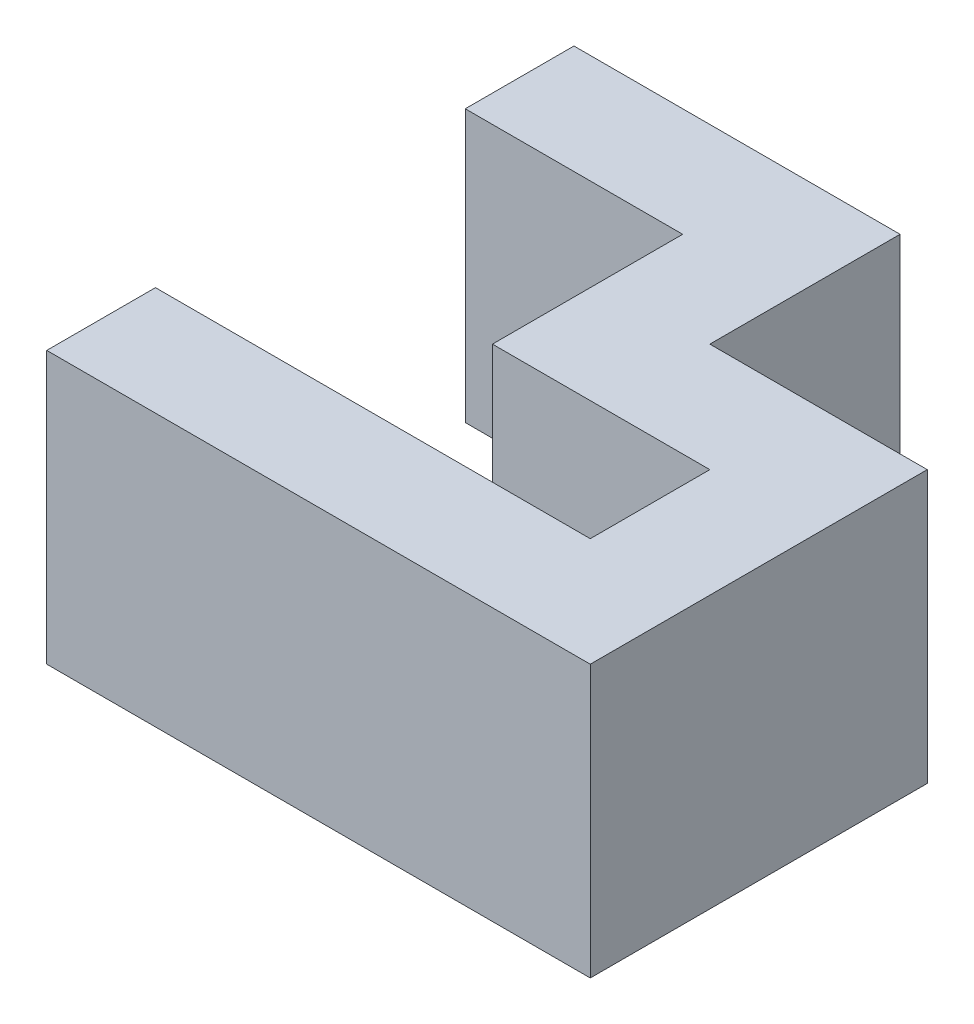
from build123d import *

# Parameters (mm, degrees)
BOSS_EXTRUDE1_DEPTH = 5


with BuildPart() as part:
    # Sketch1 → Boss-Extrude1 (new body)
    with BuildSketch(Plane(origin=(0, 0, 0), x_dir=(1, 0, 0), z_dir=(0, 1, 0))):
        Polygon((0, 0), (10, 0), (10, 6.2), (6, 6.2), (6, 9.7), (0, 9.7), (0, 7.7), (4, 7.7), (4, 4.2), (8, 4.2), (8, 2), (0, 2), align=None)
    extrude(amount=BOSS_EXTRUDE1_DEPTH)


solid = part.part
